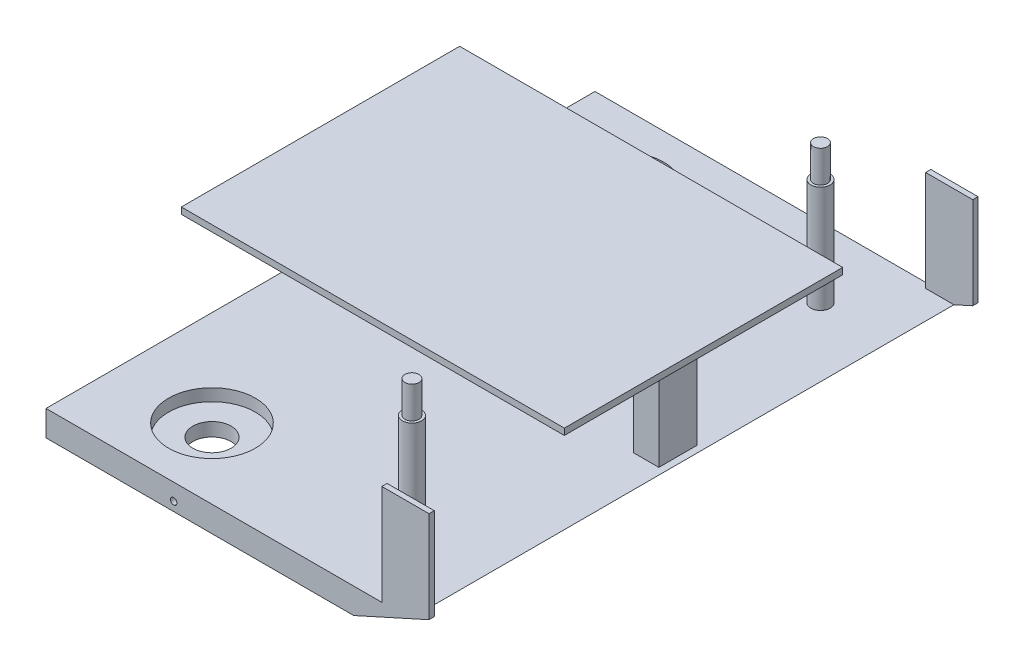
from build123d import *

# Parameters (mm, degrees)
SKETCH2_W           = 300
SKETCH2_H           = 430
BOSS_EXTRUDE1_DEPTH = 20
SKETCH3_R           = 15
CUT_EXTRUDE1_DEPTH  = 20
SKETCH4_R           = 34
CUT_EXTRUDE2_DEPTH  = 9.5
SKETCH5_R           = 7.5
BOSS_EXTRUDE2_DEPTH = 108.65
CUT_EXTRUDE4_START  = -25
SKETCH6_R           = 7.5
SKETCH6_R_2         = 5.5
CUT_EXTRUDE4_DEPTH  = 25
SKETCH7_W           = 20
SKETCH7_H           = 30
BOSS_EXTRUDE3_DEPTH = 78.65
SKETCH8_W           = 300
SKETCH8_H           = 218
BOSS_EXTRUDE4_DEPTH = 5
SKETCH12_R          = 2.5
CUT_EXTRUDE7_DEPTH  = 4
SKETCH13_W          = 36.95235035
SKETCH13_H          = 4.108205057
BOSS_EXTRUDE5_DEPTH = 78.6
SKETCH15_W          = 36.95235035
SKETCH15_H          = 4.108205057
BOSS_EXTRUDE6_DEPTH = 78.65
CUT_EXTRUDE8_DEPTH  = 474.234426579
SKETCH17_R          = 2.5
CUT_EXTRUDE9_DEPTH  = 474.234426579


with BuildPart() as part:
    # Sketch2 → Boss-Extrude1 (new body)
    with BuildSketch(Plane(origin=(0, 0, 0), x_dir=(1, 0, 0), z_dir=(0, 1, 0))):
        Rectangle(SKETCH2_W, SKETCH2_H)
    extrude(amount=BOSS_EXTRUDE1_DEPTH)

    # Sketch3 → Cut-Extrude1 (cut)
    with BuildSketch(Plane(origin=(0, 20, 0), x_dir=(1, 0, 0), z_dir=(0, 1, 0))):
        with Locations(Location((-75, 160, 0), (0, 0, 270))):
            Circle(SKETCH3_R)
        with Locations(Location((-75, -160, 0), (0, 0, 90))):
            Circle(SKETCH3_R)
    extrude(amount=-CUT_EXTRUDE1_DEPTH, mode=Mode.SUBTRACT)

    # Sketch4 → Cut-Extrude2 (cut)
    with BuildSketch(Plane(origin=(0, 20, 0), x_dir=(1, 0, 0), z_dir=(0, 1, 0))):
        with Locations(Location((-75, 160, 0), (0, 0, 270))):
            Circle(SKETCH4_R)
        with Locations(Location((-75, -160, 0), (0, 0, 90))):
            Circle(SKETCH4_R)
    extrude(amount=-CUT_EXTRUDE2_DEPTH, mode=Mode.SUBTRACT)

    # Sketch5 → Boss-Extrude2 (add)
    with BuildSketch(Plane(origin=(0, 20, 0), x_dir=(1, 0, 0), z_dir=(0, 1, 0))):
        with Locations(Location((81.635568617, 160, 0), (0, 0, 90))):
            Circle(SKETCH5_R)
        with Locations(Location((81.635568617, -160, 0), (0, 0, 90))):
            Circle(SKETCH5_R)
    extrude(amount=BOSS_EXTRUDE2_DEPTH)

    # Sketch6 → Cut-Extrude4 (cut)
    # profile 1 of 2: a face of its own
    with BuildSketch(Plane(origin=(0, 128.65, 0), x_dir=(1, 0, 0), z_dir=(0, 1, 0)).offset(CUT_EXTRUDE4_START)):
        with Locations(Location((81.635568617, -160, 0), (0, 0, 90))):
            Circle(SKETCH6_R)
        with Locations(Location((81.635568617, -160, 0), (0, 0, 270))):
            Circle(SKETCH6_R_2, mode=Mode.SUBTRACT)
    # profile 2 of 2: a face of its own
    with BuildSketch(Plane(origin=(0, 128.65, 0), x_dir=(1, 0, 0), z_dir=(0, 1, 0)).offset(CUT_EXTRUDE4_START)):
        with Locations(Location((81.635568617, 160, 0), (0, 0, 90))):
            Circle(SKETCH6_R)
        with Locations(Location((81.635568617, 160, 0), (0, 0, 90))):
            Circle(SKETCH6_R_2, mode=Mode.SUBTRACT)
    extrude(amount=CUT_EXTRUDE4_DEPTH, mode=Mode.SUBTRACT)

    # Sketch7 → Boss-Extrude3 (add)
    with BuildSketch(Plane(origin=(0, 20, 0), x_dir=(1, 0, 0), z_dir=(0, 1, 0))):
        with Locations((120, 0)):
            Rectangle(SKETCH7_W, SKETCH7_H)
        with Locations((-120, 0)):
            Rectangle(SKETCH7_W, SKETCH7_H)
    extrude(amount=BOSS_EXTRUDE3_DEPTH)

    # Sketch8 → Boss-Extrude4 (add)
    with BuildSketch(Plane(origin=(0, 98.65, 0), x_dir=(1, 0, 0), z_dir=(0, 1, 0))):
        Rectangle(SKETCH8_W, SKETCH8_H)
    extrude(amount=BOSS_EXTRUDE4_DEPTH)

    # Sketch12 → Cut-Extrude7 (cut)
    with BuildSketch(Plane.XZ.offset(-98.65)):
        with Locations(Location((144.5, 80.981198611, 0), (0, 0, 270))):
            Circle(SKETCH12_R)
        with Locations(Location((144.5, 36.981198611, 0), (0, 0, 270))):
            Circle(SKETCH12_R)
        with Locations(Location((144.5, -80.981198611, 0), (0, 0, 90))):
            Circle(SKETCH12_R)
        with Locations(Location((144.5, -36.981198611, 0), (0, 0, 90))):
            Circle(SKETCH12_R)
    extrude(amount=-CUT_EXTRUDE7_DEPTH, mode=Mode.SUBTRACT)

    # Sketch13 → Boss-Extrude5 (add)
    with BuildSketch(Plane(origin=(0, 20, 0), x_dir=(1, 0, 0), z_dir=(0, 1, 0))):
        with Locations((131.523824825, -212.945897472)):
            Rectangle(SKETCH13_W, SKETCH13_H)
    extrude(amount=BOSS_EXTRUDE5_DEPTH)

    # Sketch15 → Boss-Extrude6 (add)
    with BuildSketch(Plane(origin=(0, 20, 0), x_dir=(1, 0, 0), z_dir=(0, 1, 0))):
        with Locations((131.523824825, 212.945897472)):
            Rectangle(SKETCH15_W, SKETCH15_H)
    extrude(amount=BOSS_EXTRUDE6_DEPTH)

    # Sketch16 → Cut-Extrude8 (cut, through all)
    with BuildSketch(Plane.XY.offset(215)):
        Polygon((90.986671156, 0), (150, 26.663239915), (150, 0), align=None)
    extrude(amount=-CUT_EXTRUDE8_DEPTH, mode=Mode.SUBTRACT)

    # Sketch17 → Cut-Extrude9 (cut, through all)
    with BuildSketch(Plane.XY.offset(215)):
        with Locations((-50, 7)):
            Circle(SKETCH17_R)
    extrude(amount=-CUT_EXTRUDE9_DEPTH, mode=Mode.SUBTRACT)


solid = part.part
